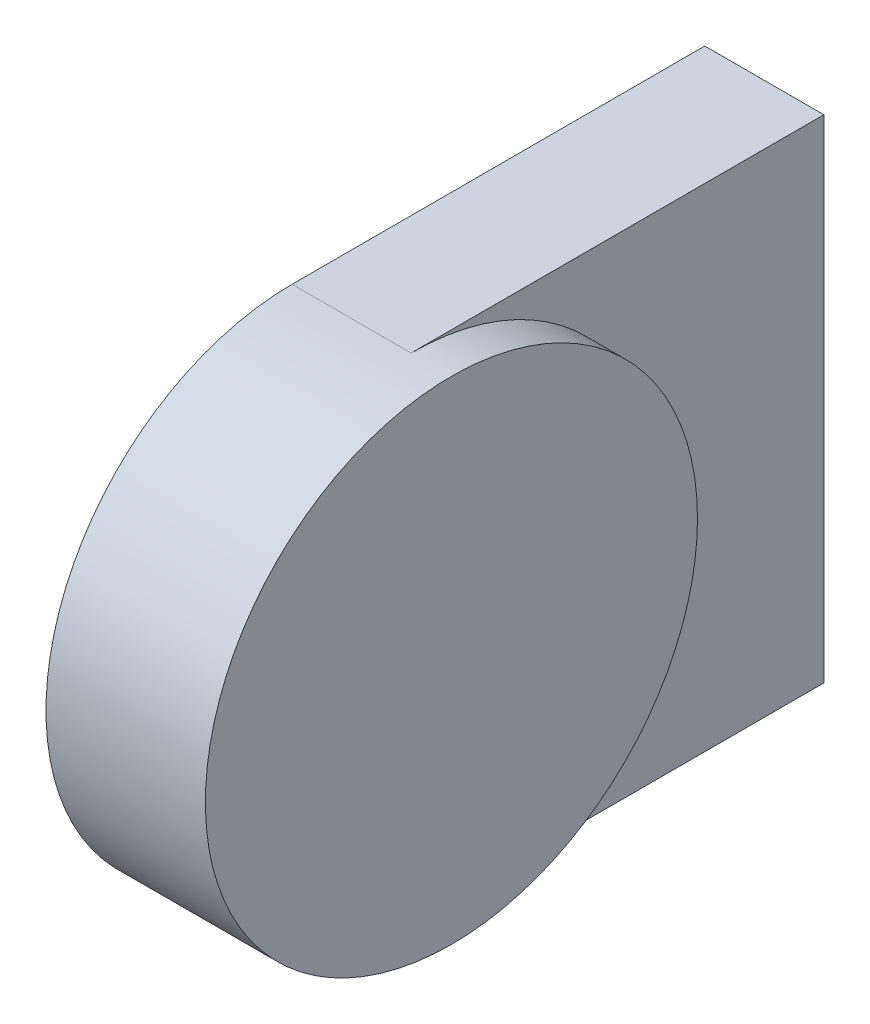
from build123d import *

# Parameters (mm, degrees)
BOSS_EXTRUDE1_DEPTH = 75
SKETCH2_R           = 155
BOSS_EXTRUDE2_DEPTH = 25.4


with BuildPart() as part:
    # Sketch1 → Boss-Extrude1 (new body)
    with BuildSketch(Plane.YZ):
        with BuildLine():
            Line((-155, 0), (-155, -260))
            Line((-155, -260), (155, -260))
            Line((155, -260), (155, 0))
            ThreePointArc((155, 0), (0, 155), (-155, 0))
        make_face()
    extrude(amount=BOSS_EXTRUDE1_DEPTH)

    # Sketch2 → Boss-Extrude2 (add)
    with BuildSketch(Plane(origin=(75, 0, 0), x_dir=(0, 0, -1), z_dir=(1, 0, 0))):
        with Locations(Location((0, 0, 0), (0, 0, 270))):
            Circle(SKETCH2_R)
    extrude(amount=BOSS_EXTRUDE2_DEPTH)


solid = part.part
